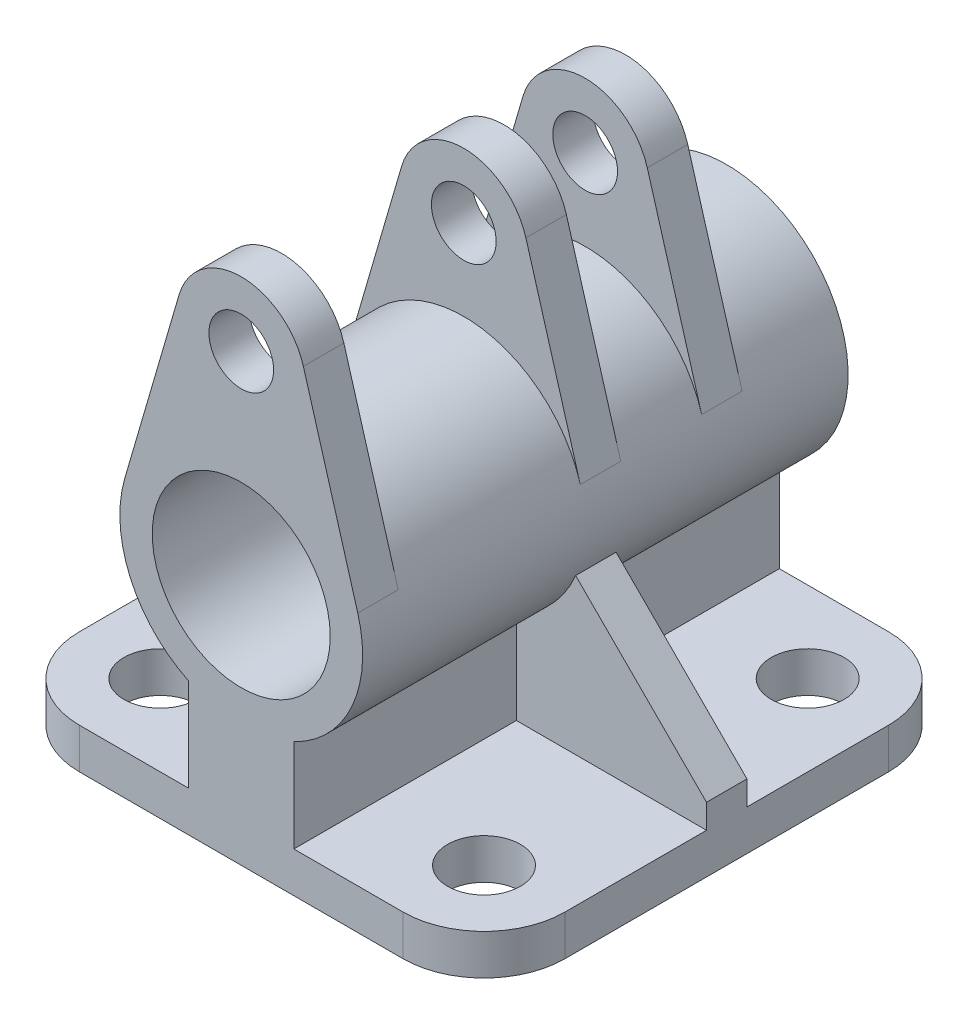
from build123d import *

# Parameters (mm, degrees)
SKETCH_1_R               = 15
SKETCH_1_R_2             = 11
EXTRUDE_3_DEPTH          = 30
SKETCH_1_6_R             = 4
EXTRUDE_4_DEPTH          = 2.5
EXTRUDE_START            = -15
SKETCH_1_9_R             = 4
EXTRUDE_5_DEPTH          = 2.5
EXTRUDE_START_2          = 25
SKETCH_1_12_R            = 4
EXTRUDE_7_DEPTH          = 5
SKETCH_3_R               = 4.5
CUT_EXTRUDE_3_DEPTH      = 76.953933407
MIRROR_2_COPY_1_SKETCH_R = 4.5
MIRROR_2_COPY_1_DEPTH    = 76.953933407
FILLET_1_R               = 10


with BuildPart() as part:
    # Эскиз1 → Бобышка-Вытянуть3 (new, symmetric)
    # profile 1 of 2: a face of its own
    with BuildSketch(Plane.XY):
        Circle(SKETCH_1_R)
        Circle(SKETCH_1_R_2, mode=Mode.SUBTRACT)
    # profile 2 of 2: a face of its own
    with BuildSketch(Plane.XY):
        with BuildLine():
            Line((6.5, -25), (6.5, -13.518505835))
            ThreePointArc((6.5, -13.518505835), (0, -15), (-6.5, -13.518505835))
            Line((-6.5, -13.518505835), (-6.5, -25))
            Line((-6.5, -25), (-30, -25))
            Line((-30, -25), (-30, -30))
            Line((-30, -30), (30, -30))
            Line((30, -30), (30, -25))
            Line((30, -25), (6.5, -25))
        make_face()
    extrude(amount=EXTRUDE_3_DEPTH, both=True)

    # Эскиз1<6> → Бобышка-Вытянуть4 (add, symmetric)
    # profile 1 of 3: a face of its own
    with BuildSketch(Plane.XY):
        with BuildLine():
            Line((-7.68, 27.24), (-14.4, 4.2))
            ThreePointArc((-14.4, 4.2), (0, 15), (14.4, 4.2))
            Line((14.4, 4.2), (7.68, 27.24))
            ThreePointArc((7.68, 27.24), (0, 33), (-7.68, 27.24))
        make_face()
        with Locations((0, 25)):
            Circle(SKETCH_1_6_R, mode=Mode.SUBTRACT)
    # profile 2 of 3: a face of its own
    with BuildSketch(Plane.XY):
        with BuildLine():
            ThreePointArc((13.823441352, -5.823441352), (10.865729218, -10.340982959), (6.5, -13.518505835))
            Line((6.5, -13.518505835), (6.5, -25))
            Line((6.5, -25), (30, -25))
            Line((30, -25), (30, -22))
            Line((30, -22), (13.823441352, -5.823441352))
        make_face()
    # profile 3 of 3: a face of its own
    with BuildSketch(Plane.XY):
        with BuildLine():
            Line((-6.5, -25), (-6.5, -13.518505835))
            ThreePointArc((-6.5, -13.518505835), (-10.865729218, -10.340982959), (-13.823441352, -5.823441352))
            Line((-13.823441352, -5.823441352), (-30, -22))
            Line((-30, -22), (-30, -25))
            Line((-30, -25), (-6.5, -25))
        make_face()
    extrude(amount=EXTRUDE_4_DEPTH, both=True)

    # Эскиз1<9> → Бобышка-Вытянуть5 (add, symmetric)
    with BuildSketch(Plane.XY.offset(EXTRUDE_START)):
        with BuildLine():
            Line((-7.68, 27.24), (-14.4, 4.2))
            ThreePointArc((-14.4, 4.2), (0, 15), (14.4, 4.2))
            Line((14.4, 4.2), (7.68, 27.24))
            ThreePointArc((7.68, 27.24), (0, 33), (-7.68, 27.24))
        make_face()
        with Locations((0, 25)):
            Circle(SKETCH_1_9_R, mode=Mode.SUBTRACT)
    extrude(amount=EXTRUDE_5_DEPTH, both=True)

    # Эскиз1<12> → Бобышка-Вытянуть7 (add)
    with BuildSketch(Plane.XY.offset(EXTRUDE_START_2)):
        with BuildLine():
            Line((-7.68, 27.24), (-14.4, 4.2))
            ThreePointArc((-14.4, 4.2), (0, 15), (14.4, 4.2))
            Line((14.4, 4.2), (7.68, 27.24))
            ThreePointArc((7.68, 27.24), (0, 33), (-7.68, 27.24))
        make_face()
        with Locations((0, 25)):
            Circle(SKETCH_1_12_R, mode=Mode.SUBTRACT)
    extrude(amount=EXTRUDE_7_DEPTH)

    # Эскиз3 → Вырез-Вытянуть3 (cut, through all)
    with BuildSketch(Plane.XZ.offset(30)):
        with Locations((20, -20)):
            Circle(SKETCH_3_R)
    cut_extrude_3 = extrude(amount=-CUT_EXTRUDE_3_DEPTH, mode=Mode.SUBTRACT)

    # Зеркальное отражение1: Вырез-Вытянуть3 across plane
    add(cut_extrude_3.mirror(Plane(origin=(0, 0, 0), x_dir=(0, 0, 1), z_dir=(1, 0, 0))), mode=Mode.SUBTRACT)

    # Зеркальное отражение2: Вырез-Вытянуть3 across plane
    add(cut_extrude_3.mirror(Plane.XY), mode=Mode.SUBTRACT)

    # Зеркальное отражение2 copy 1 sketch → Зеркальное отражение2 copy 1 (cut, through all)
    with BuildSketch(Plane(origin=(0, -30, 0), x_dir=(-1, 0, 0), z_dir=(0, -1, 0))):
        with Locations((20, -20)):
            Circle(MIRROR_2_COPY_1_SKETCH_R)
    extrude(amount=-MIRROR_2_COPY_1_DEPTH, mode=Mode.SUBTRACT)

    # Скругление1
    fillet_1_edges = [part.edges().sort_by_distance(p)[0] for p in [
        (30, -27.5, -30),
        (-30, -27.5, -30),
        (-30, -27.5, 30),
        (30, -27.5, 30),
    ]]
    fillet(fillet_1_edges, radius=FILLET_1_R)


solid = part.part
